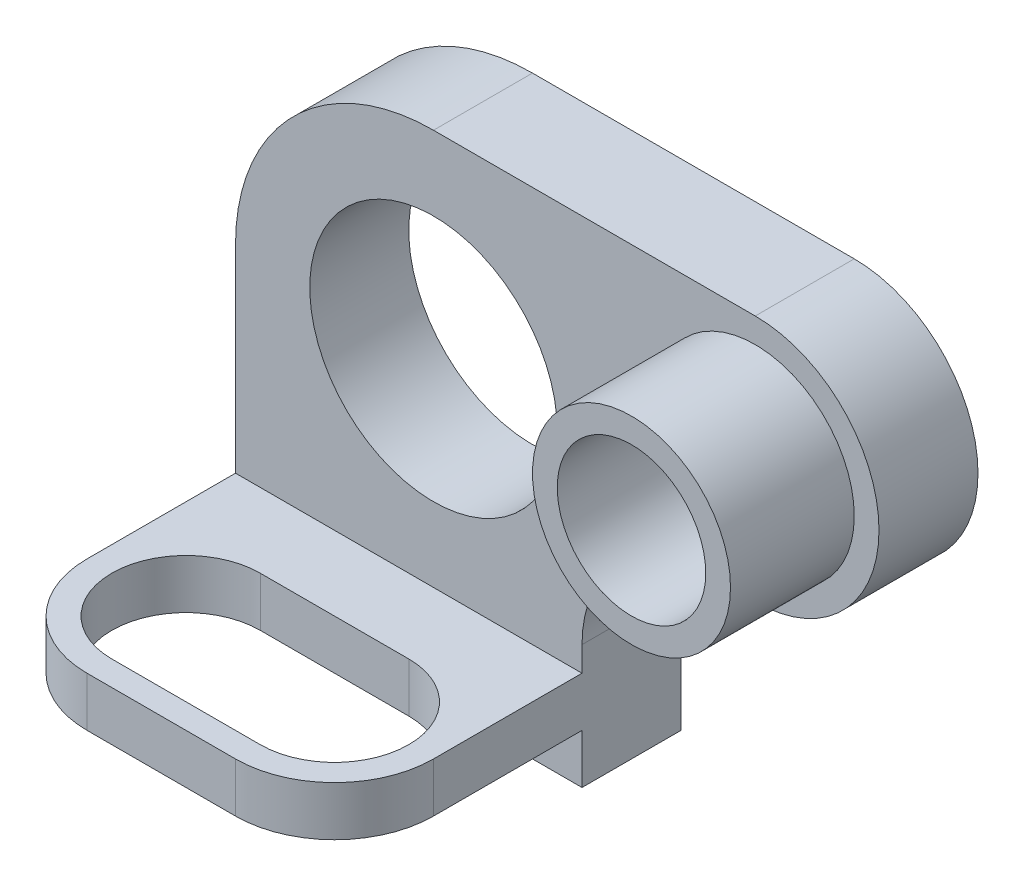
from build123d import *

# Parameters (mm, degrees)
SKETCH1_R                = 25
SKETCH1_R_2              = 20
BOSS_EXTRUDE1_DEPTH      = 20
SKETCH1_W                = 70
SKETCH1_H                = 10
BOSS_EXTRUDE1_2_DEPTH    = 20
BOSS_EXTRUDE2_DEPTH      = 50
BOSS_EXTRUDE2_DEPTH_BACK = 20
SKETCH1_4_W              = 70
SKETCH1_4_H              = 10
BOSS_EXTRUDE3_DEPTH      = 25
BOSS_EXTRUDE3_DEPTH_BACK = 20
SKETCH1_5_R              = 20
SKETCH1_5_R_2            = 15
FILLET1_R                = 20
CUT_EXTRUDE1_DEPTH       = 161.623784042


with BuildPart() as part:
    # Sketch1 → Boss-Extrude1 (new body)
    with BuildSketch(Plane.XY):
        with BuildLine():
            Line((0, 60), (0, 20))
            Line((0, 20), (70, 20))
            Line((70, 20), (70, 25))
            ThreePointArc((70, 25), (77.32233047, 42.67766953), (95, 50))
            Line((95, 50), (105, 50))
            ThreePointArc((105, 50), (130, 75), (105, 100))
            Line((105, 100), (40, 100))
            ThreePointArc((40, 100), (11.715728753, 88.284271247), (0, 60))
        make_face()
        with Locations((40, 60)):
            Circle(SKETCH1_R, mode=Mode.SUBTRACT)
        with Locations((105, 75)):
            Circle(SKETCH1_R_2, mode=Mode.SUBTRACT)
    extrude(amount=-BOSS_EXTRUDE1_DEPTH)



with BuildPart() as body_2:
    # Sketch1 → Boss-Extrude1 2 (new body)
    with BuildSketch(Plane.XY):
        with Locations((35, 5)):
            Rectangle(SKETCH1_W, SKETCH1_H)
    extrude(amount=-BOSS_EXTRUDE1_2_DEPTH)


with BuildPart() as part_1:
    add(part.part)

    add(body_2.part)  # Boss-Extrude2 merges body 2
    # Sketch1<4> → Boss-Extrude2 (add, two sides: drawn at the far end of the back side and taken through both)
    with BuildSketch(Plane.XY.offset(-BOSS_EXTRUDE2_DEPTH_BACK)):
        with Locations((35, 15)):
            Rectangle(SKETCH1_4_W, SKETCH1_4_H)
    extrude(amount=BOSS_EXTRUDE2_DEPTH + BOSS_EXTRUDE2_DEPTH_BACK)

    # Sketch1<5> → Boss-Extrude3 (add, two sides: drawn at the far end of the back side and taken through both)
    with BuildSketch(Plane.XY.offset(-BOSS_EXTRUDE3_DEPTH_BACK)):
        with Locations((105, 75)):
            Circle(SKETCH1_5_R)
        with Locations((105, 75)):
            Circle(SKETCH1_5_R_2, mode=Mode.SUBTRACT)
    extrude(amount=BOSS_EXTRUDE3_DEPTH + BOSS_EXTRUDE3_DEPTH_BACK)

    # Fillet1
    fillet1_edges = [part_1.edges().sort_by_distance(p)[0] for p in [
        (70, 15, 50),
        (0, 15, 50),
    ]]
    fillet(fillet1_edges, radius=FILLET1_R)

    # Sketch2 → Cut-Extrude1 (cut, through all)
    with BuildSketch(Plane(origin=(0, 20, 0), x_dir=(1, 0, 0), z_dir=(0, 1, 0))):
        with BuildLine():
            Line((20, -15), (50, -15))
            ThreePointArc((50, -15), (65, -30), (50, -45))
            Line((50, -45), (20, -45))
            ThreePointArc((20, -45), (5, -30), (20, -15))
        make_face()
    extrude(amount=-CUT_EXTRUDE1_DEPTH, mode=Mode.SUBTRACT)


solid = part_1.part
